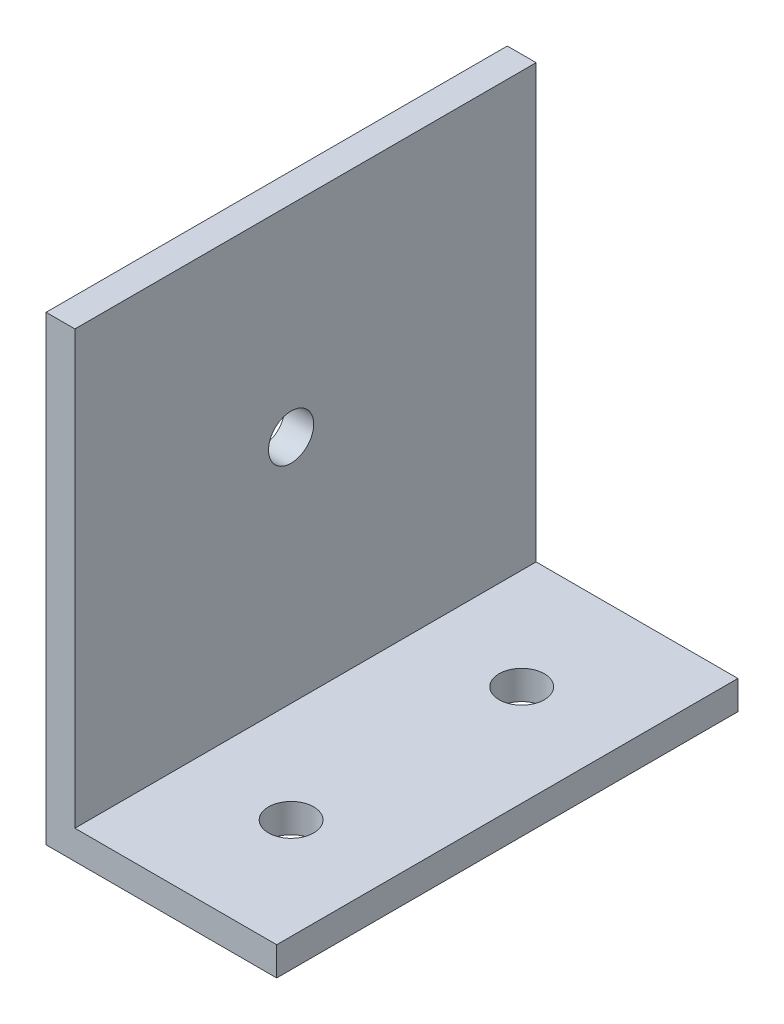
from build123d import *

# Parameters (mm, degrees)
BOSS_EXTRUDE1_DEPTH = 50.8
SKETCH2_R           = 2.4892
CUT_EXTRUDE1_DEPTH  = 77.2
SKETCH3_R           = 2.4892
CUT_EXTRUDE2_DEPTH  = 77.2


with BuildPart() as part:
    # Sketch1 → Boss-Extrude1 (new body)
    with BuildSketch(Plane.XY):
        Polygon((0, 0), (0, 50.8), (3.175, 50.8), (3.175, 3.175), (25.4, 3.175), (25.4, 0), align=None)
    extrude(amount=BOSS_EXTRUDE1_DEPTH)

    # Sketch2 → Cut-Extrude1 (cut, through all)
    with BuildSketch(Plane(origin=(0, 0, 0), x_dir=(0, 0, -1), z_dir=(1, 0, 0))):
        with Locations(Location((-26.9875, 28.575, 0), (0, 0, 270))):
            Circle(SKETCH2_R)
    extrude(amount=CUT_EXTRUDE1_DEPTH, mode=Mode.SUBTRACT)

    # Sketch3 → Cut-Extrude2 (cut, through all)
    with BuildSketch(Plane(origin=(0, 0, 0), x_dir=(1, 0, 0), z_dir=(0, 1, 0))):
        with Locations(Location((14.2875, -38.1, 0), (0, 0, 90))):
            Circle(SKETCH3_R)
        with Locations(Location((14.2875, -12.7, 0), (0, 0, 90))):
            Circle(SKETCH3_R)
    extrude(amount=CUT_EXTRUDE2_DEPTH, mode=Mode.SUBTRACT)


solid = part.part
